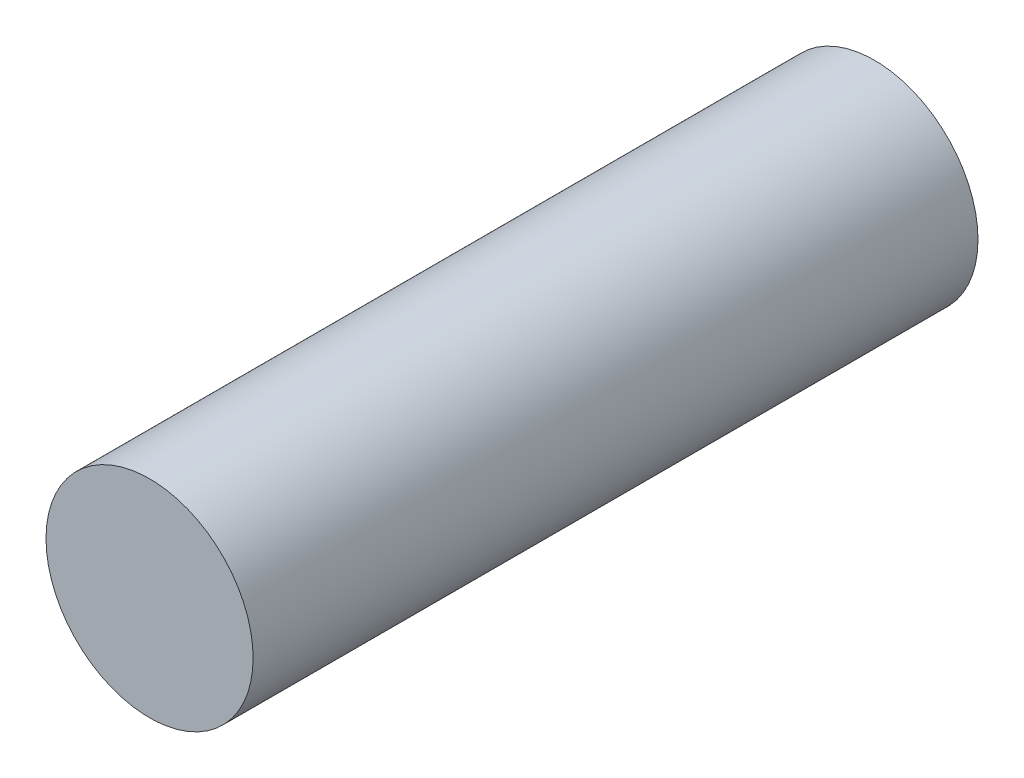
from build123d import *

# Parameters (mm, degrees)
SKETCH1_R           = 2
BOSS_EXTRUDE1_DEPTH = 14


with BuildPart() as part:
    # Sketch1 → Boss-Extrude1 (new body)
    with BuildSketch(Plane.XY):
        with Locations((-2.045140046, 0)):
            Circle(SKETCH1_R)
    extrude(amount=BOSS_EXTRUDE1_DEPTH)


solid = part.part
